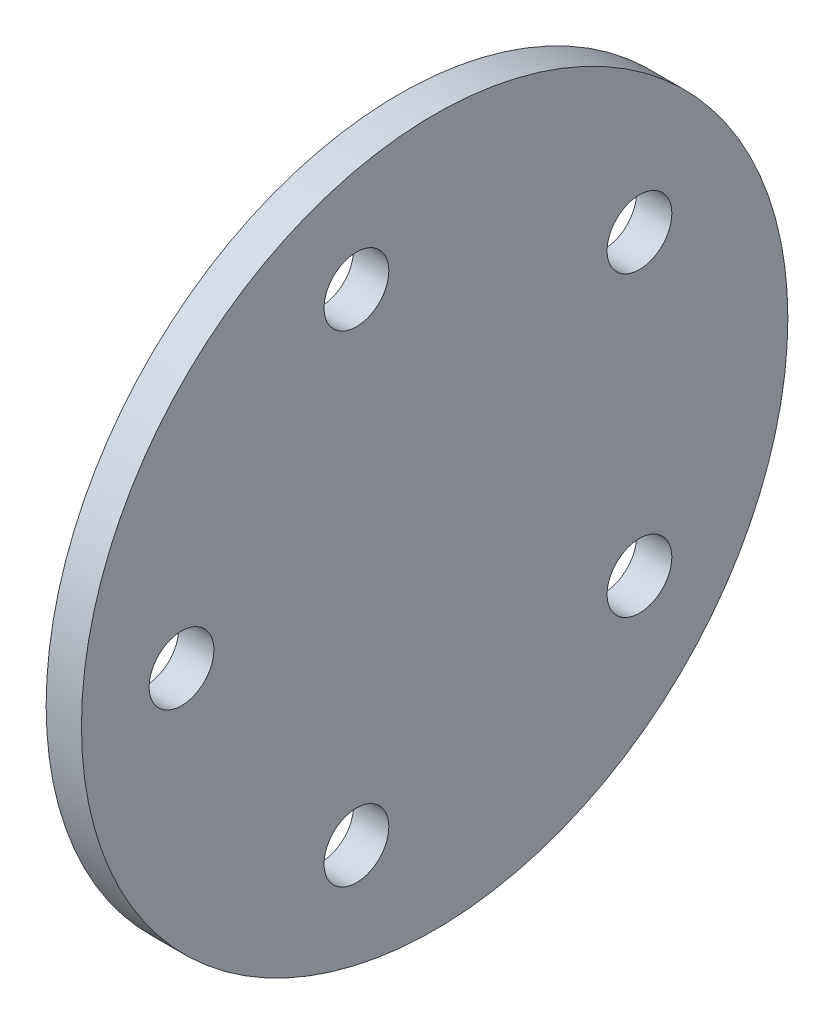
from build123d import *

# Parameters (mm, degrees)
SKETCH1_R           = 30
SKETCH1_R_2         = 2.75
BOSS_EXTRUDE1_DEPTH = 3


with BuildPart() as part:
    # Sketch1 → Boss-Extrude1 (new body)
    with BuildSketch(Plane.YZ):
        with Locations(Location((0, 0, 0), (0, 0, 270))):
            Circle(SKETCH1_R)
        with Locations(Location((0, 21.5, 0), (0, 0, 270))):
            Circle(SKETCH1_R_2, mode=Mode.SUBTRACT)
        with Locations(Location((20.4477151, 6.643865379, 0), (0, 0, 270))):
            Circle(SKETCH1_R_2, mode=Mode.SUBTRACT)
        with Locations(Location((12.637382924, -17.393865379, 0), (0, 0, 270))):
            Circle(SKETCH1_R_2, mode=Mode.SUBTRACT)
        with Locations(Location((-12.637382924, -17.393865379, 0), (0, 0, 270))):
            Circle(SKETCH1_R_2, mode=Mode.SUBTRACT)
        with Locations(Location((-20.4477151, 6.643865379, 0), (0, 0, 270))):
            Circle(SKETCH1_R_2, mode=Mode.SUBTRACT)
    extrude(amount=BOSS_EXTRUDE1_DEPTH)


solid = part.part
